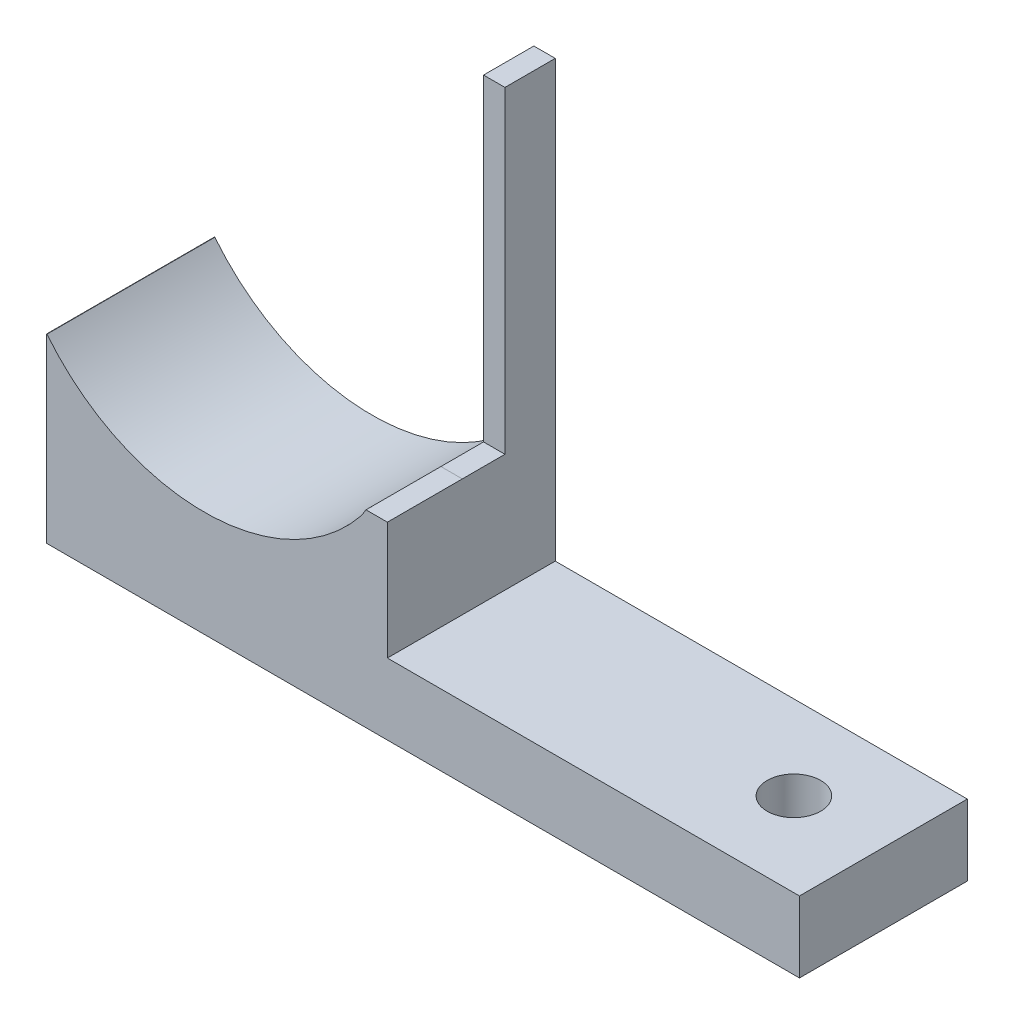
from build123d import *

# Parameters (mm, degrees)
SKETCH1_W           = 42.2
SKETCH1_H           = 9.41
BOSS_EXTRUDE1_DEPTH = 5.95
SKETCH2_W           = 23.1
SKETCH2_H           = 0.95
CUT_EXTRUDE1_DEPTH  = 10
SKETCH3_W           = 19.1
SKETCH3_H           = 9.41
BOSS_EXTRUDE2_DEPTH = 24.37
CUT_EXTRUDE8_DEPTH  = 20
SKETCH6_W           = 17.9
SKETCH6_H           = 9.41
CUT_EXTRUDE9_DEPTH  = 20.15
BOSS_EXTRUDE4_DEPTH = 9.41
SKETCH9_W           = 1.2
SKETCH9_H           = 4.2
CUT_EXTRUDE10_DEPTH = 19.74
SKETCH10_W          = 5.21
SKETCH10_H          = 1.92911269
CUT_EXTRUDE11_DEPTH = 19.74
SKETCH11_W          = 1.2
SKETCH11_H          = 2.39
CUT_EXTRUDE13_DEPTH = 17.810638
SKETCH12_W          = 9.41
SKETCH12_H          = 1.01654614
CUT_EXTRUDE14_DEPTH = 23.1
SKETCH13_R          = 1.5
CUT_EXTRUDE15_DEPTH = 23.1


with BuildPart() as part:
    # Sketch1 → Boss-Extrude1 (new body)
    with BuildSketch(Plane(origin=(0, 0, 0), x_dir=(1, 0, 0), z_dir=(0, 1, 0))):
        Rectangle(SKETCH1_W, SKETCH1_H)
    extrude(amount=BOSS_EXTRUDE1_DEPTH)

    # Sketch2 → Cut-Extrude1 (cut)
    with BuildSketch(Plane.XY.offset(4.705)):
        with Locations((9.55, 5.475)):
            Rectangle(SKETCH2_W, SKETCH2_H)
    extrude(amount=-CUT_EXTRUDE1_DEPTH, mode=Mode.SUBTRACT)

    # Sketch3 → Boss-Extrude2 (add)
    with BuildSketch(Plane(origin=(0, 5.95, 0), x_dir=(1, 0, 0), z_dir=(0, 1, 0))):
        with Locations((-11.55, 0)):
            Rectangle(SKETCH3_W, SKETCH3_H)
    extrude(amount=BOSS_EXTRUDE2_DEPTH)

    # Sketch5 → Cut-Extrude8 (cut)
    with BuildSketch(Plane(origin=(0, 0, -4.705), x_dir=(-1, 0, 0), z_dir=(0, 0, -1))):
        with BuildLine():
            Line((3.2, 10.501800084), (21.087895638, 10.16983908))
            ThreePointArc((21.087895638, 10.16983908), (12.062256205, 5.933823433), (3.2, 10.501800084))
        make_face()
    extrude(amount=-CUT_EXTRUDE8_DEPTH, mode=Mode.SUBTRACT)

    # Sketch6 → Cut-Extrude9 (cut)
    with BuildSketch(Plane(origin=(0, 30.32, 0), x_dir=(1, 0, 0), z_dir=(0, 1, 0))):
        with Locations((-12.15, 0)):
            Rectangle(SKETCH6_W, SKETCH6_H)
    extrude(amount=-CUT_EXTRUDE9_DEPTH, mode=Mode.SUBTRACT)

    # Sketch8 → Boss-Extrude4 (add)
    with BuildSketch(Plane.XY.offset(4.705)):
        Polygon((-3.455417816, 10.17), (-3.2, 10.580249423), (-3.2, 10.17), align=None)
    extrude(amount=-BOSS_EXTRUDE4_DEPTH)

    # Sketch9 → Cut-Extrude10 (cut)
    with BuildSketch(Plane(origin=(0, 30.32, 0), x_dir=(1, 0, 0), z_dir=(0, 1, 0))):
        with Locations((-2.6, -2.605)):
            Rectangle(SKETCH9_W, SKETCH9_H)
    extrude(amount=-CUT_EXTRUDE10_DEPTH, mode=Mode.SUBTRACT)

    # Sketch10 → Cut-Extrude11 (cut)
    with BuildSketch(Plane(origin=(-2, 0, 0), x_dir=(0, 0, -1), z_dir=(1, 0, 0))):
        with Locations((2.1, 29.355443655)):
            Rectangle(SKETCH10_W, SKETCH10_H)
    extrude(amount=-CUT_EXTRUDE11_DEPTH, mode=Mode.SUBTRACT)

    # Sketch11 → Cut-Extrude13 (cut)
    with BuildSketch(Plane(origin=(0, 28.39088731, 0), x_dir=(1, 0, 0), z_dir=(0, 1, 0))):
        with Locations((-2.6, 0.69)):
            Rectangle(SKETCH11_W, SKETCH11_H)
    extrude(amount=-CUT_EXTRUDE13_DEPTH, mode=Mode.SUBTRACT)

    # Sketch12 → Cut-Extrude14 (cut)
    with BuildSketch(Plane(origin=(21.1, 0, 0), x_dir=(0, 0, -1), z_dir=(1, 0, 0))):
        with Locations((0, 4.49172693)):
            Rectangle(SKETCH12_W, SKETCH12_H)
    extrude(amount=-CUT_EXTRUDE14_DEPTH, mode=Mode.SUBTRACT)

    # Sketch13 → Cut-Extrude15 (cut)
    with BuildSketch(Plane(origin=(0, 3.98345386, 0), x_dir=(1, 0, 0), z_dir=(0, 1, 0))):
        with Locations(Location((16.083417544, 0, 0), (0, 0, 270))):
            Circle(SKETCH13_R)
    extrude(amount=-CUT_EXTRUDE15_DEPTH, mode=Mode.SUBTRACT)


solid = part.part
